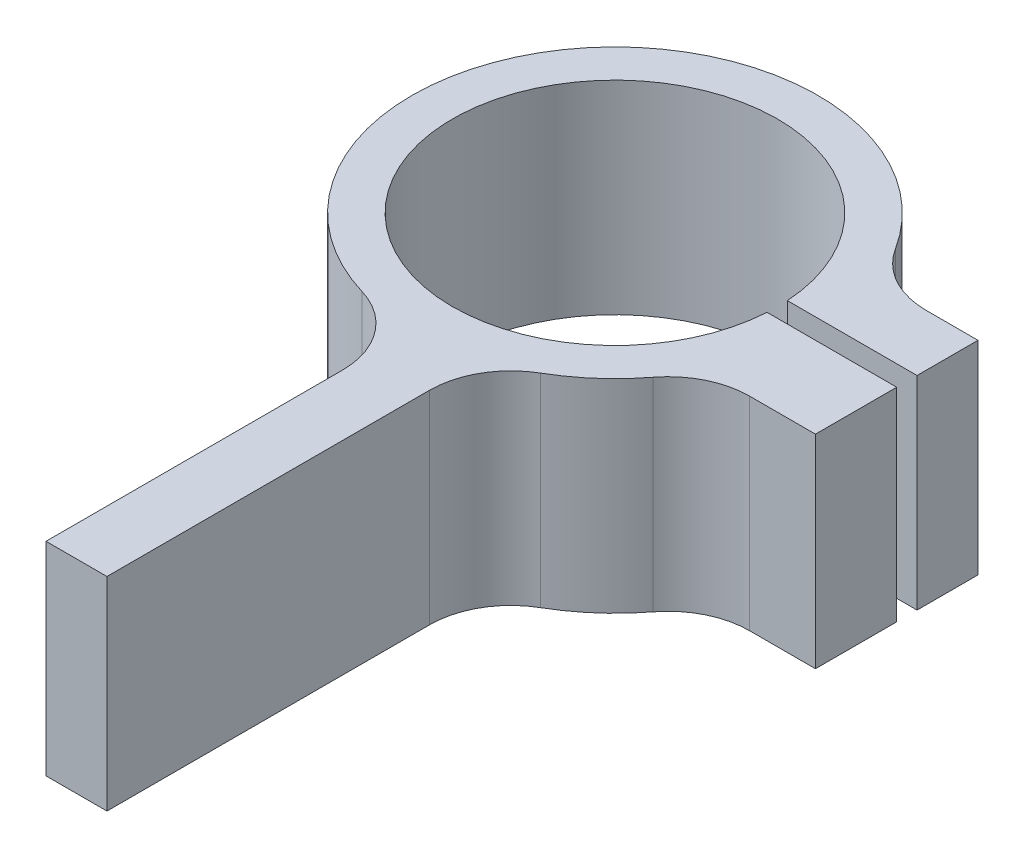
from build123d import *

# Parameters (mm, degrees)
BOSS_EXTRUDE1_DEPTH = 10
FILLET1_R           = 4


with BuildPart() as part:
    # Sketch1 → Boss-Extrude1 (new body)
    with BuildSketch(Plane(origin=(0, 0, 0), x_dir=(1, 0, 0), z_dir=(0, 1, 0))):
        with BuildLine():
            Line((0, -10), (0, -28))
            Line((0, -28), (3, -28))
            Line((3, -28), (3, -9.539392014))
            ThreePointArc((3, -9.539392014), (6.47547653, -7.620249583), (8.93028555, -4.5))
            Line((8.93028555, -4.5), (14.367496998, -4.5))
            Line((14.367496998, -4.5), (14.367496998, -0.5))
            Line((14.367496998, -0.5), (9.987492178, -0.5))
            Line((9.987492178, -0.5), (7.984359711, -0.5))
            ThreePointArc((7.984359711, -0.5), (-8, 0), (7.984359711, 0.5))
            Line((7.984359711, 0.5), (9.987492178, 0.5))
            Line((9.987492178, 0.5), (14.367496998, 0.5))
            Line((14.367496998, 0.5), (14.367496998, 3.5))
            Line((14.367496998, 3.5), (9.367496998, 3.5))
            ThreePointArc((9.367496998, 3.5), (-8.215838363, 5.700877125), (0, -10))
        make_face()
    extrude(amount=BOSS_EXTRUDE1_DEPTH)

    # Fillet1
    fillet1_edges = [part.edges().sort_by_distance(p)[0] for p in [
        (8.93028555, 5, 4.5),
        (3, 5, 9.539392014),
        (0, 5, 10),
        (9.367496998, 5, -3.5),
    ]]
    fillet(fillet1_edges, radius=FILLET1_R)


solid = part.part
